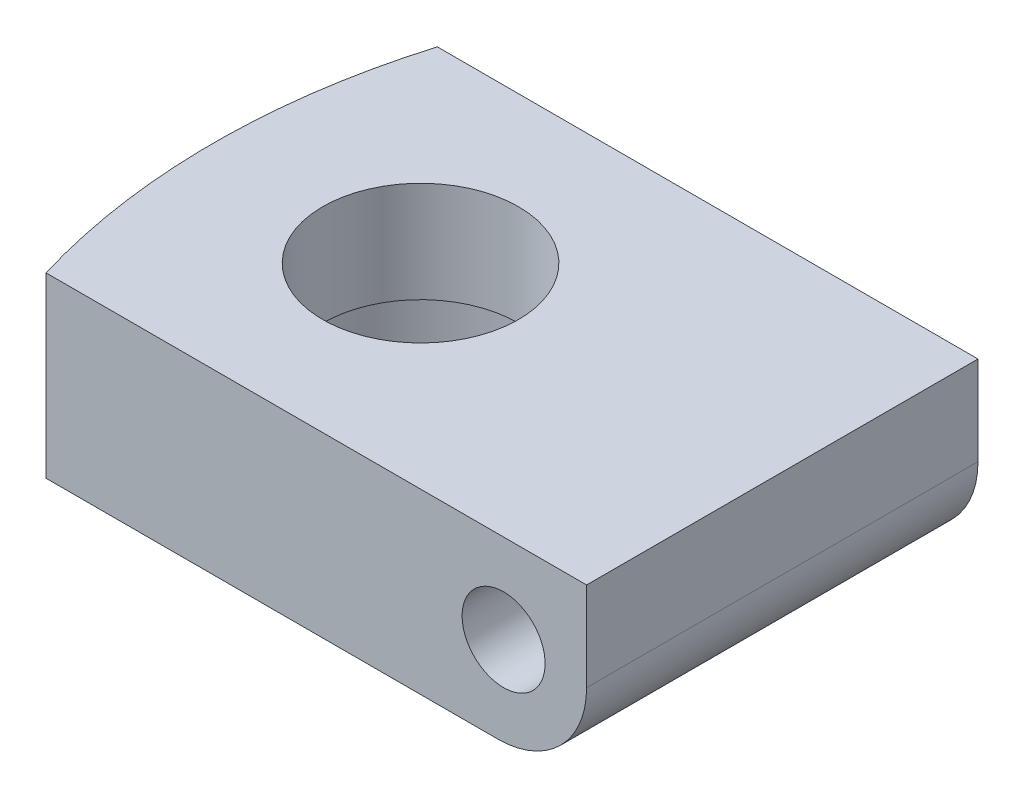
from build123d import *

# Parameters (mm, degrees)
BOSS_EXTRUDE1_DEPTH = 30
SKETCH2_R           = 22.5
CUT_EXTRUDE1_DEPTH  = 13
SKETCH3_R           = 16.5
CUT_EXTRUDE2_DEPTH  = 61.679485825
FILLET1_R           = 15


with BuildPart() as part:
    # Sketch1 → Boss-Extrude1 (new body)
    with BuildSketch(Plane(origin=(0, 0, 0), x_dir=(1, 0, 0), z_dir=(0, 1, 0))):
        with BuildLine():
            ThreePointArc((-43.163514831, 33), (-48, 0), (-43.163514831, -33))
            Line((-43.163514831, -33), (48, -33))
            Line((48, -33), (48, 33))
            Line((48, 33), (-43.163514831, 33))
        make_face()
    extrude(amount=BOSS_EXTRUDE1_DEPTH)

    # Sketch2 → Cut-Extrude1 (cut)
    with BuildSketch(Plane.XZ):
        with Locations(Location((-13, 0, 0), (0, 0, 270))):
            Circle(SKETCH2_R)
    extrude(amount=-CUT_EXTRUDE1_DEPTH, mode=Mode.SUBTRACT)

    # Sketch3 → Cut-Extrude2 (cut, through all)
    with BuildSketch(Plane.XZ.offset(-13)):
        with Locations(Location((-13, 0, 0), (0, 0, 270))):
            Circle(SKETCH3_R)
    extrude(amount=-CUT_EXTRUDE2_DEPTH, mode=Mode.SUBTRACT)

    # Fillet1
    fillet1_edges = [part.edges().sort_by_distance(p)[0] for p in [
        (48, 0, 0),
    ]]
    fillet(fillet1_edges, radius=FILLET1_R)

    # Sketch4 → Cut-Revolve1 (revolve, cut)
    with BuildSketch(Plane(origin=(0, 15, 0), x_dir=(1, 0, 0), z_dir=(0, 1, 0)), mode=Mode.PRIVATE) as cut_revolve1_sk:
        Polygon((41, -33), (40.34, 33), (34, 33), (34, -33), align=None)
    revolve(cut_revolve1_sk.sketch.rotate(Axis((34, 15, -33), (0, 0, 1)), 180), axis=Axis((34, 15, -33), (0, 0, 1)), mode=Mode.SUBTRACT)


solid = part.part
